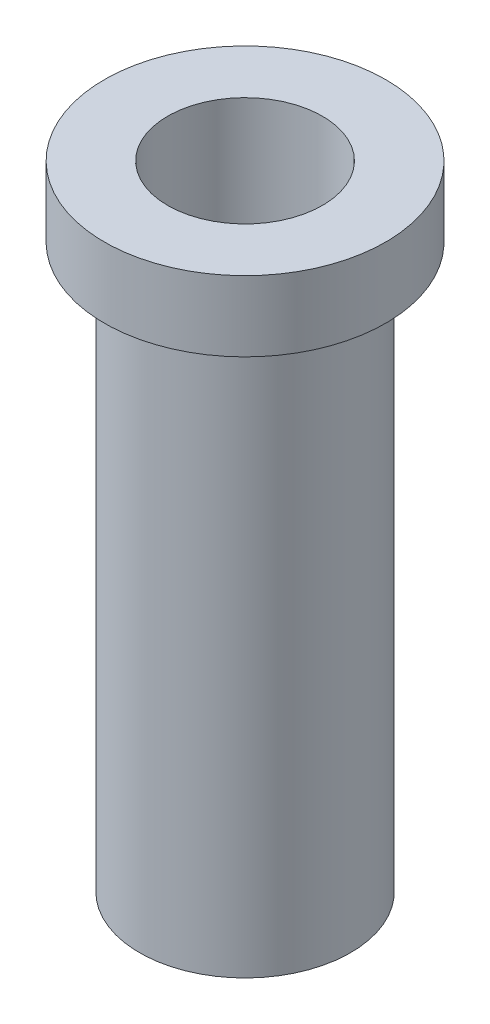
from build123d import *

# Parameters (mm, degrees)
SKETCH2_R          = 5.5
CUT_EXTRUDE1_DEPTH = 48.16990566


with BuildPart() as part:
    # Sketch1 → Revolve1 (revolve)
    with BuildSketch(Plane.XY, mode=Mode.PRIVATE) as revolve1_sk:
        Polygon((0, 0), (0, 45), (10, 45), (10, 40), (7.5, 40), (7.5, 0), align=None)
    revolve(revolve1_sk.sketch.rotate(Axis((0, 0, 0), (0, 1, 0)), 90), axis=Axis((0, 0, 0), (0, 1, 0)))

    # Sketch2 → Cut-Extrude1 (cut, through all)
    with BuildSketch(Plane(origin=(0, 45, 0), x_dir=(1, 0, 0), z_dir=(0, 1, 0))):
        with Locations(Location((0, 0, 0), (0, 0, 270))):
            Circle(SKETCH2_R)
    extrude(amount=-CUT_EXTRUDE1_DEPTH, mode=Mode.SUBTRACT)


solid = part.part
